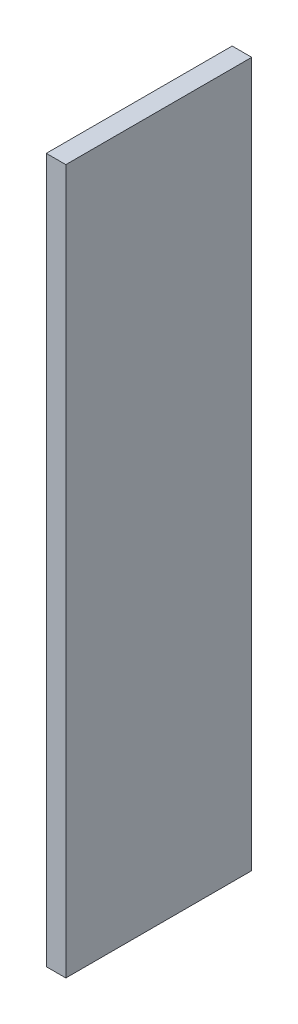
from build123d import *

# Parameters (mm, degrees)
SKETCH1_W           = 12.7
SKETCH1_H           = 120.65
BOSS_EXTRUDE1_DEPTH = 457.2


with BuildPart() as part:
    # Sketch1 → Boss-Extrude1 (new body)
    with BuildSketch(Plane(origin=(0, 25.4, 0), x_dir=(1, 0, 0), z_dir=(0, 1, 0))):
        with Locations((-298.45, 9.525)):
            Rectangle(SKETCH1_W, SKETCH1_H)
    extrude(amount=BOSS_EXTRUDE1_DEPTH)


solid = part.part
